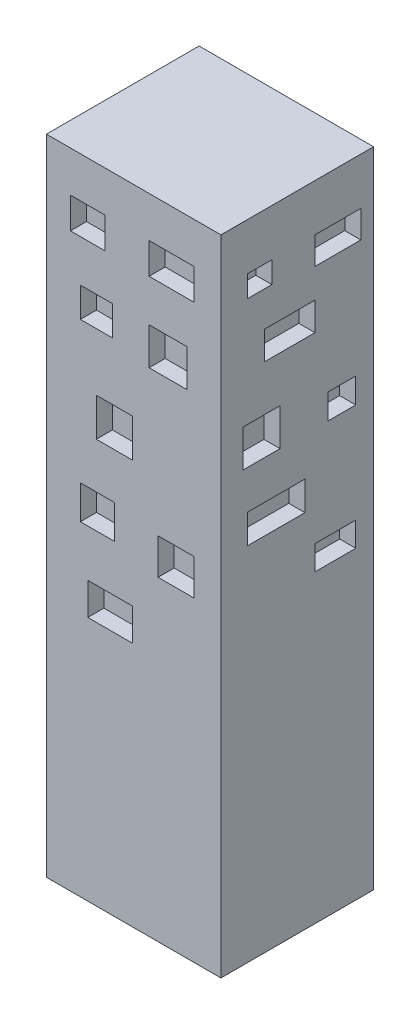
from build123d import *

# Parameters (mm, degrees)
SKETCH_2_W          = 21.686450318
SKETCH_2_H          = 18.975644028
EXTRUDE_1_DEPTH     = 80
SKETCH_3_W          = 4.325856272
SKETCH_3_H          = 3.850004403
SKETCH_3_W_2        = 5.584754458
SKETCH_3_W_3        = 3.96682231
SKETCH_3_H_2        = 3.692656783
SKETCH_3_W_4        = 4.705718876
SKETCH_3_H_3        = 4.627145628
SKETCH_3_W_5        = 4.481794252
SKETCH_3_H_4        = 4.742838382
SKETCH_3_W_6        = 4.224308281
SKETCH_3_H_5        = 4.189521493
SKETCH_3_W_7        = 4.472125562
SKETCH_3_H_6        = 4.472586404
SKETCH_3_W_8        = 5.542155091
SKETCH_3_H_7        = 4.001347562
CUT_EXTRUDE_1_DEPTH = 2
SKETCH_4_W          = 3.008522681
SKETCH_4_H          = 2.673197864
SKETCH_4_W_2        = 5.706300448
SKETCH_4_H_2        = 3.399675438
SKETCH_4_W_3        = 6.296507583
SKETCH_4_H_3        = 3.509528199
SKETCH_4_W_4        = 4.633699799
SKETCH_4_H_4        = 4.622885298
SKETCH_4_W_5        = 3.431694386
SKETCH_4_H_5        = 3.11922744
SKETCH_4_W_6        = 7.114178537
SKETCH_4_H_6        = 3.614354853
SKETCH_4_W_7        = 5.071310287
SKETCH_4_H_7        = 3.04134768
CUT_EXTRUDE_2_DEPTH = 2


with BuildPart() as part:
    # Эскиз2 → Бобышка-Вытянуть1 (new body)
    with BuildSketch(Plane(origin=(0, 0, 0), x_dir=(1, 0, 0), z_dir=(0, 1, 0))):
        with Locations((-10.843225159, 9.487822014)):
            Rectangle(SKETCH_2_W, SKETCH_2_H)
    extrude(amount=EXTRUDE_1_DEPTH)

    # Эскиз3 → Вырез-Вытянуть1 (cut)
    with BuildSketch(Plane.XY):
        with Locations((-16.546390401, 73.000252652)):
            Rectangle(SKETCH_3_W, SKETCH_3_H)
        with Locations((-6.133816144, 73.000252652)):
            Rectangle(SKETCH_3_W_2, SKETCH_3_H)
        with Locations((-15.486029562, 64.011252425)):
            Rectangle(SKETCH_3_W_3, SKETCH_3_H_2)
        with Locations((-6.573333935, 63.544008002)):
            Rectangle(SKETCH_3_W_4, SKETCH_3_H_3)
        with Locations((-13.245132436, 52.626011155)):
            Rectangle(SKETCH_3_W_5, SKETCH_3_H_4)
        with Locations((-15.357286577, 42.478535232)):
            Rectangle(SKETCH_3_W_6, SKETCH_3_H_5)
        with Locations((-5.577501696, 41.464970569)):
            Rectangle(SKETCH_3_W_7, SKETCH_3_H_6)
        with Locations((-13.775312856, 32.542849067)):
            Rectangle(SKETCH_3_W_8, SKETCH_3_H_7)
    extrude(amount=-CUT_EXTRUDE_1_DEPTH, mode=Mode.SUBTRACT)

    # Эскиз4 → Вырез-Вытянуть2 (cut)
    with BuildSketch(Plane(origin=(0, 0, 0), x_dir=(0, 0, -1), z_dir=(1, 0, 0))):
        with Locations((4.831613066, 72.817657134)):
            Rectangle(SKETCH_4_W, SKETCH_4_H)
        with Locations((14.543739986, 72.454418347)):
            Rectangle(SKETCH_4_W_2, SKETCH_4_H_2)
        with Locations((8.54233597, 65.380205413)):
            Rectangle(SKETCH_4_W_3, SKETCH_4_H_3)
        with Locations((5.034477327, 55.62228831)):
            Rectangle(SKETCH_4_W_4, SKETCH_4_H_4)
        with Locations((15.046052856, 54.870459381)):
            Rectangle(SKETCH_4_W_5, SKETCH_4_H_5)
        with Locations((6.884440994, 46.683688672)):
            Rectangle(SKETCH_4_W_6, SKETCH_4_H_6)
        with Locations((14.226244905, 39.396398085)):
            Rectangle(SKETCH_4_W_7, SKETCH_4_H_7)
    extrude(amount=-CUT_EXTRUDE_2_DEPTH, mode=Mode.SUBTRACT)


solid = part.part
